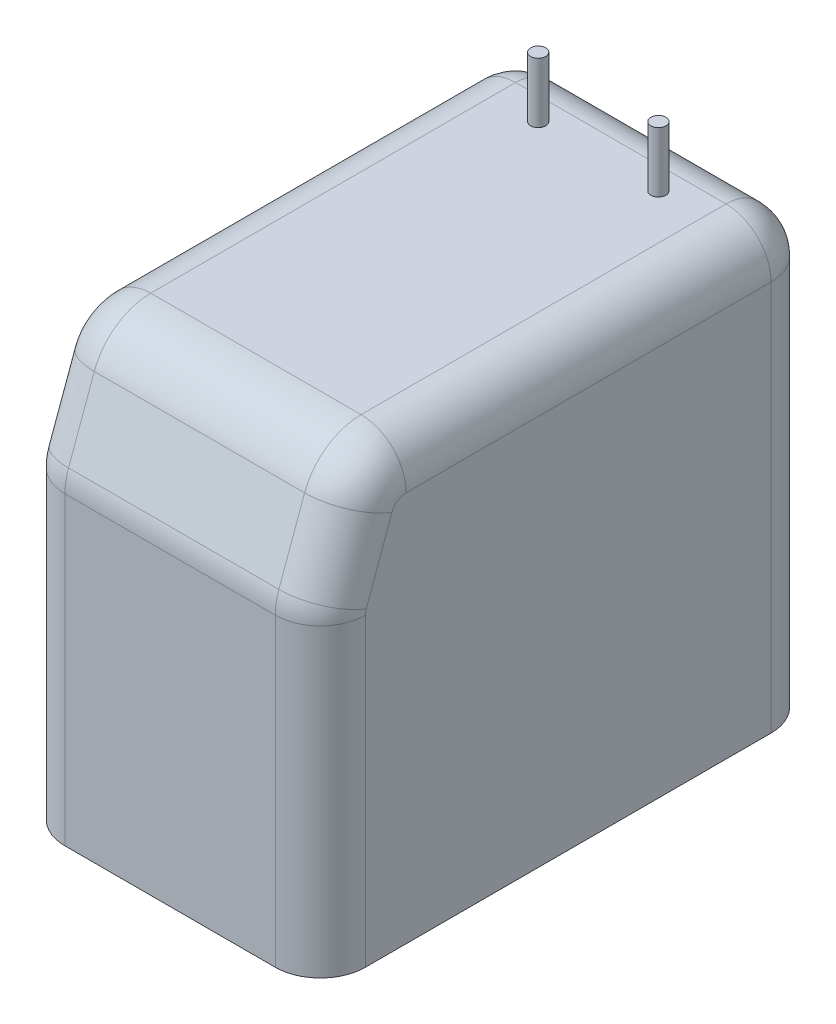
from build123d import *

# Parameters (mm, degrees)
SKETCH1_W           = 254
SKETCH1_H           = 419.1
BOSS_EXTRUDE1_DEPTH = 368.3
CHAMFER1_SIZE       = 101.6
CHAMFER1_SIZE2      = 36.979375801
FILLET1_R           = 50.8
SKETCH2_R           = 6.35
BOSS_EXTRUDE2_DEPTH = 50.8
FILLET2_R           = 38.1
FILLET3_R           = 38.1


with BuildPart() as part:
    # Sketch1 → Boss-Extrude1 (new body)
    with BuildSketch(Plane(origin=(0, 0, 0), x_dir=(1, 0, 0), z_dir=(0, 1, 0))):
        Rectangle(SKETCH1_W, SKETCH1_H)
    extrude(amount=BOSS_EXTRUDE1_DEPTH)

    # Chamfer1
    chamfer1_edges = [part.edges().sort_by_distance(p)[0] for p in [
        (0, 368.3, 209.55),
    ]]
    chamfer1_side = [part.faces().sort_by_distance(p)[0] for p in [
        (0, 184.15, 209.55),
    ]]
    chamfer(chamfer1_edges, length=CHAMFER1_SIZE, length2=CHAMFER1_SIZE2, reference=chamfer1_side[0])

    # Fillet1
    fillet1_edges = [part.edges().sort_by_distance(p)[0] for p in [
        (0, 368.3, 172.570624199),
        (0, 266.7, 209.55),
    ]]
    fillet(fillet1_edges, radius=FILLET1_R)

    # Sketch2 → Boss-Extrude2 (add)
    with BuildSketch(Plane(origin=(0, 368.3, 0), x_dir=(1, 0, 0), z_dir=(0, 1, 0))):
        with Locations(Location((-50.8, 152.4, 0), (0, 0, 270))):
            Circle(SKETCH2_R)
        with Locations(Location((50.8, 152.4, 0), (0, 0, 270))):
            Circle(SKETCH2_R)
    extrude(amount=BOSS_EXTRUDE2_DEPTH)

    # Fillet2
    fillet2_edges = [part.edges().sort_by_distance(p)[0] for p in [
        (-127, 368.3, -36.274959371),
        (127, 128.87129469, 209.55),
        (-127, 128.87129469, 209.55),
        (-127, 304.995917971, 195.611425765),
        (-127, 359.11292385, 166.137764224),
        (-127, 266.563916805, 208.778233853),
        (127, 304.995917971, 195.611425765),
        (127, 368.3, -36.274959371),
        (127, 359.11292385, 166.137764224),
        (127, 266.563916805, 208.778233853),
    ]]
    fillet(fillet2_edges, radius=FILLET2_R)

    # Fillet3
    fillet3_edges = [part.edges().sort_by_distance(p)[0] for p in [
        (0, 368.3, -209.55),
        (-127, 165.1, -209.55),
        (127, 165.1, -209.55),
        (115.840768363, 357.140768363, -209.55),
        (-115.840768363, 357.140768363, -209.55),
    ]]
    fillet(fillet3_edges, radius=FILLET3_R)


solid = part.part
